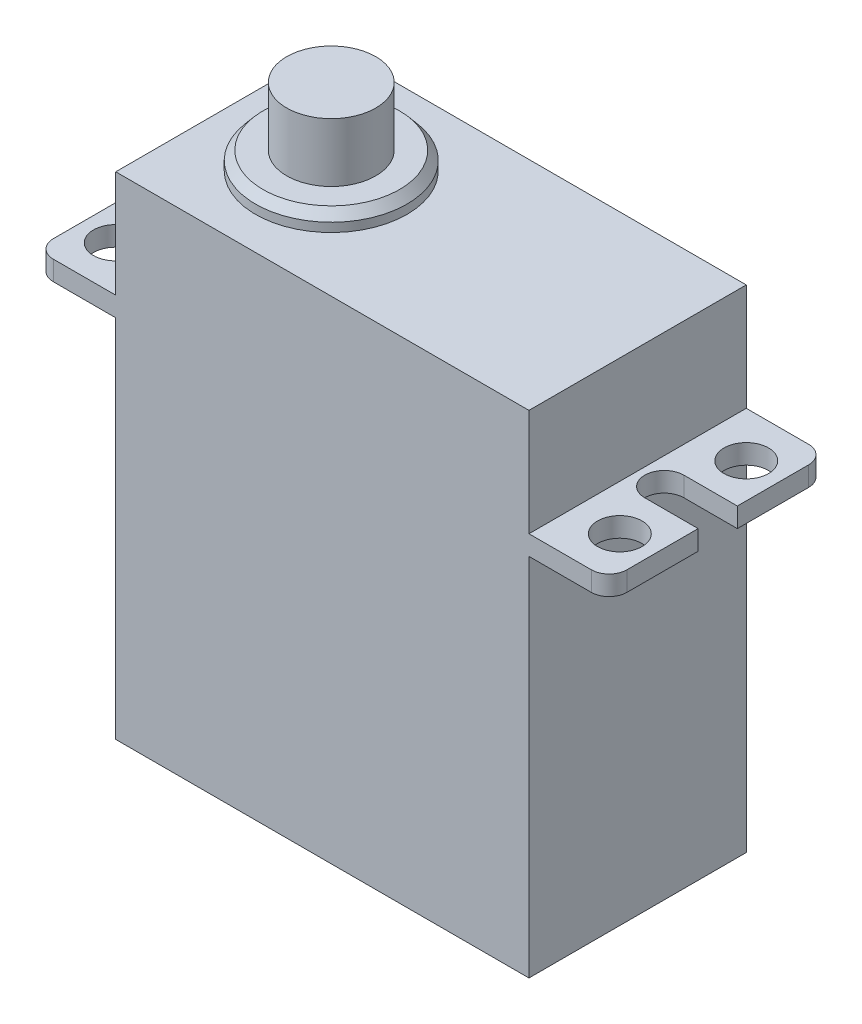
from build123d import *

# Parameters (mm, degrees)
BOSS_EXTRUDE1_DEPTH     = 6.1
SKETCH3_R               = 1.25
CUT_EXTRUDE1_DEPTH      = 28.622092607
MIRROR1_COPY_1_SKETCH_R = 1.25
MIRROR1_COPY_1_DEPTH    = 28.622092607
FILLET1_R               = 1


with BuildPart() as part:
    # Sketch1 → Boss-Extrude1 (new, symmetric)
    with BuildSketch(Plane.XY):
        Polygon((11.6, 7.8), (16.1, 7.8), (16.1, 6.7), (11.6, 6.7), (11.6, -13.8), (-11.6, -13.8), (-11.6, 6.7), (-16.1, 6.7), (-16.1, 7.8), (-11.6, 7.8), (-11.6, 13.8), (11.6, 13.8), align=None)
    extrude(amount=BOSS_EXTRUDE1_DEPTH, both=True)

    # Sketch2 → Revolve1 (revolve)
    with BuildSketch(Plane.XY, mode=Mode.PRIVATE) as revolve1_sk:
        Polygon((-5.6, 18.1), (-8.1, 18.1), (-8.1, 14.8), (-9.430450184, 14.8), (-9.85, 14.3), (-9.85, 13.8), (-5.6, 13.8), align=None)
    revolve(revolve1_sk.sketch.rotate(Axis((-5.6, 13.8, 0), (0, 1, 0)), 270), axis=Axis((-5.6, 13.8, 0), (0, 1, 0)))

    # Sketch3 → Cut-Extrude1 (cut, through all)
    with BuildSketch(Plane(origin=(0, 7.8, 0), x_dir=(1, 0, 0), z_dir=(0, 1, 0))):
        with Locations(Location((14.15, 3.55, 0), (0, 0, 270))):
            Circle(SKETCH3_R)
        with BuildLine():
            Line((16.1, 0), (13.1, 0))
            Line((13.1, 0), (12, 0))
            ThreePointArc((12, 0), (12.322182541, 0.777817459), (13.1, 1.1))
            Line((13.1, 1.1), (16.1, 1.1))
            Line((16.1, 1.1), (16.1, 0))
        make_face()
    cut_extrude1 = extrude(amount=-CUT_EXTRUDE1_DEPTH, mode=Mode.SUBTRACT)

    # Mirror4: Cut-Extrude1 across plane
    add(cut_extrude1.mirror(Plane(origin=(0, 0, 0), x_dir=(0, 0, 1), z_dir=(1, 0, 0))), mode=Mode.SUBTRACT)

    # Mirror1: Cut-Extrude1 across plane
    add(cut_extrude1.mirror(Plane(origin=(16.1, -13.8, 0), x_dir=(1, 0, 0), z_dir=(0, 0, 1))), mode=Mode.SUBTRACT)

    # Mirror1 copy 1 sketch → Mirror1 copy 1 (cut, through all)
    with BuildSketch(Plane(origin=(0, 7.8, 0), x_dir=(-1, 0, 0), z_dir=(0, 1, 0))):
        with Locations(Location((14.15, 3.55, 0), (0, 0, 270))):
            Circle(MIRROR1_COPY_1_SKETCH_R)
        with BuildLine():
            Line((16.1, 0), (13.1, 0))
            Line((13.1, 0), (12, 0))
            ThreePointArc((12, 0), (12.322182541, 0.777817459), (13.1, 1.1))
            Line((13.1, 1.1), (16.1, 1.1))
            Line((16.1, 1.1), (16.1, 0))
        make_face()
    extrude(amount=-MIRROR1_COPY_1_DEPTH, mode=Mode.SUBTRACT)

    # Fillet1
    fillet1_edges = [part.edges().sort_by_distance(p)[0] for p in [
        (-16.1, 7.25, 6.1),
        (16.1, 7.25, -6.1),
        (-16.1, 7.25, -6.1),
        (16.1, 7.25, 6.1),
    ]]
    fillet(fillet1_edges, radius=FILLET1_R)


solid = part.part
